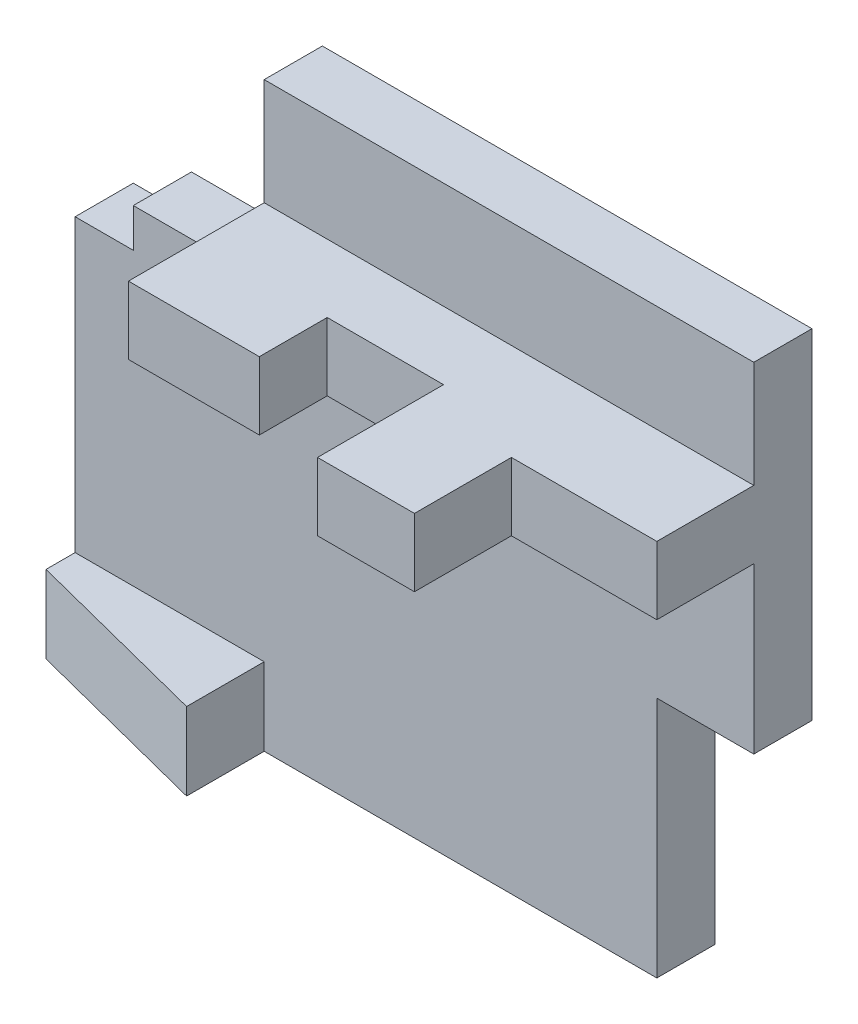
from build123d import *

# Parameters (mm, degrees)
EXTRUDE_1_DEPTH     = 6
EXTRUDE_3_DEPTH     = 8
SKETCH_3_W          = 3
SKETCH_3_H          = 14
CUT_EXTRUDE_1_DEPTH = 47
SKETCH_4_W          = 50.5
SKETCH_4_H          = 7
EXTRUDE_4_DEPTH     = 20
CUT_EXTRUDE_2_REACH = 67.59
SKETCH_5_W          = 13.5
SKETCH_5_H          = 6
SKETCH_5_W_2        = 15
SKETCH_5_H_2        = 10


with BuildPart() as part:
    # Эскиз1 → Бобышка-Вытянуть1 (new body)
    with BuildSketch(Plane.XY):
        Polygon((-35, 8), (-35, -30), (25, -30), (25, -5), (35, -5), (35, 30), (-15.5, 30), (-15.5, 12), (-29, 12), (-29, 8), align=None)
    extrude(amount=EXTRUDE_1_DEPTH)

    # Эскиз2 → Бобышка-Вытянуть3 (add)
    with BuildSketch(Plane.XZ.offset(30)):
        Polygon((-35, 6), (-35, 9), (-15.5, 14), (-15.5, 6), align=None)
    extrude(amount=-EXTRUDE_3_DEPTH)

    # Эскиз3 → Вырез-Вытянуть1 (cut)
    with BuildSketch(Plane.ZY.offset(35)):
        with Locations((1.5, -6)):
            Rectangle(SKETCH_3_W, SKETCH_3_H)
    extrude(amount=-CUT_EXTRUDE_1_DEPTH, mode=Mode.SUBTRACT)

    # Эскиз4 → Бобышка-Вытянуть4 (add)
    with BuildSketch(Plane.XY.offset(6)):
        with Locations((9.75, 15.5)):
            Rectangle(SKETCH_4_W, SKETCH_4_H)
    extrude(amount=EXTRUDE_4_DEPTH)

    # Эскиз5 → Вырез-Вытянуть2 (cut, up to next)
    with BuildSketch(Plane(origin=(0, 19, 0), x_dir=(1, 0, 0), z_dir=(0, 1, 0)), mode=Mode.PRIVATE) as cut_extrude_2_sk1:
        Polygon((-2, -26), (10, -26), (10, -13), (-2, -13), (-2, -20), align=None)
    cut_extrude_2_tool1 = extrude(cut_extrude_2_sk1.sketch, amount=-CUT_EXTRUDE_2_REACH, mode=Mode.PRIVATE) & part.part
    # Эскиз5 → Вырез-Вытянуть2 (cut, up to next)
    with BuildSketch(Plane(origin=(0, 19, 0), x_dir=(1, 0, 0), z_dir=(0, 1, 0)), mode=Mode.PRIVATE) as cut_extrude_2_sk2:
        with Locations((-8.75, -23)):
            Rectangle(SKETCH_5_W, SKETCH_5_H)
    cut_extrude_2_tool2 = extrude(cut_extrude_2_sk2.sketch, amount=-CUT_EXTRUDE_2_REACH, mode=Mode.PRIVATE) & part.part
    # Эскиз5 → Вырез-Вытянуть2 (cut, up to next)
    with BuildSketch(Plane(origin=(0, 19, 0), x_dir=(1, 0, 0), z_dir=(0, 1, 0)), mode=Mode.PRIVATE) as cut_extrude_2_sk3:
        with Locations((27.5, -21)):
            Rectangle(SKETCH_5_W_2, SKETCH_5_H_2)
    cut_extrude_2_tool3 = extrude(cut_extrude_2_sk3.sketch, amount=-CUT_EXTRUDE_2_REACH, mode=Mode.PRIVATE) & part.part
    add(cut_extrude_2_tool1.solids().sort_by_distance((4, 19, 19.5))[0], mode=Mode.SUBTRACT)
    add(cut_extrude_2_tool2.solids().sort_by_distance((-8.75, 19, 23))[0], mode=Mode.SUBTRACT)
    add(cut_extrude_2_tool3.solids().sort_by_distance((27.5, 19, 21))[0], mode=Mode.SUBTRACT)


solid = part.part
